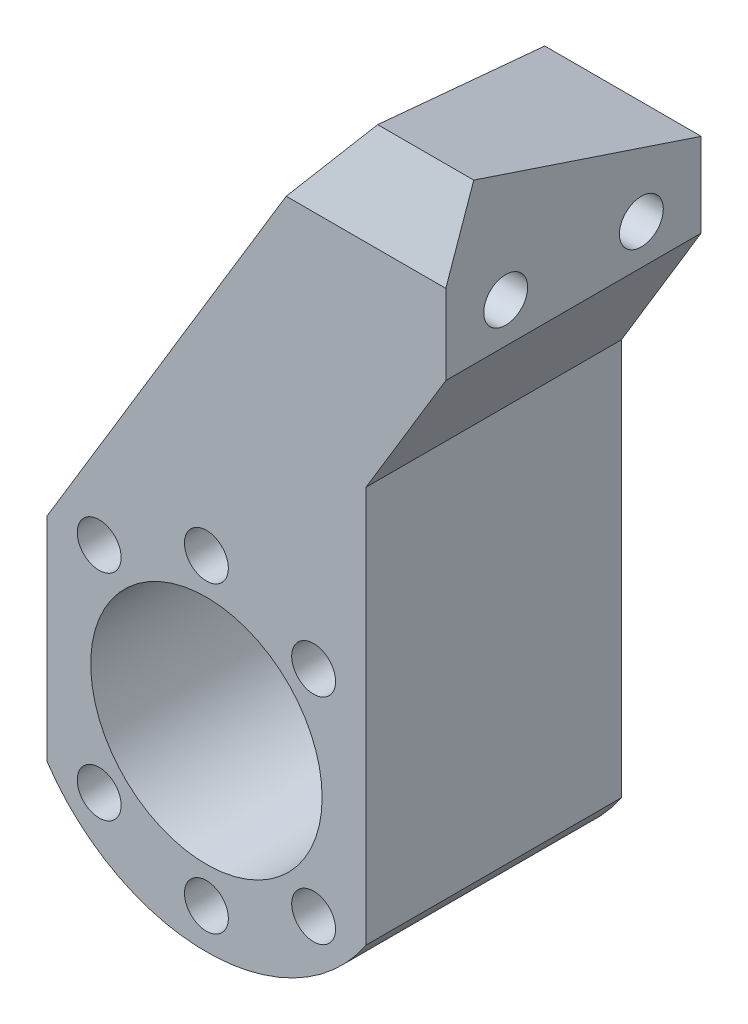
from build123d import *

# Parameters (mm, degrees)
ESQUISSE2_R             = 2.75
ESQUISSE2_R_2           = 14.5
BOSS_EXTRU_1_DEPTH      = 32
BOSS_EXTRU_4_DEPTH      = 32
ENL_V_MAT_EXTRU_3_REACH = 88.563
ESQUISSE10_R            = 2.75
BOSS_EXTRU_6_DEPTH      = 20
ENL_V_MAT_EXTRU_4_REACH = 87.165
ENL_V_MAT_EXTRU_5_REACH = 91.18
ESQUISSE13_R            = 6


with BuildPart() as part:
    # Esquisse2 → Boss.-Extru.1 (new body)
    with BuildSketch(Plane.XY):
        with BuildLine():
            Line((20, 13.266499161), (20, -13.266499161))
            ThreePointArc((20, -13.266499161), (0, -24), (-20, -13.266499161))
            Line((-20, -13.266499161), (-20, 13.266499161))
            ThreePointArc((-20, 13.266499161), (0, 24), (20, 13.266499161))
        make_face()
        with Locations((0, 19)):
            Circle(ESQUISSE2_R, mode=Mode.SUBTRACT)
        with Locations((-13.435028843, 13.435028843)):
            Circle(ESQUISSE2_R, mode=Mode.SUBTRACT)
        with Locations((13.435028843, 13.435028843)):
            Circle(ESQUISSE2_R, mode=Mode.SUBTRACT)
        with Locations((0, -19)):
            Circle(ESQUISSE2_R, mode=Mode.SUBTRACT)
        with Locations((13.435028843, -13.435028843)):
            Circle(ESQUISSE2_R, mode=Mode.SUBTRACT)
        with Locations((-13.435028843, -13.435028843)):
            Circle(ESQUISSE2_R, mode=Mode.SUBTRACT)
        Circle(ESQUISSE2_R_2, mode=Mode.SUBTRACT)
    extrude(amount=BOSS_EXTRU_1_DEPTH)

    # Esquisse7 → Boss.-Extru.4 (add)
    with BuildSketch(Plane(origin=(0, 0, 0), x_dir=(-1, 0, 0), z_dir=(0, 0, -1))):
        with BuildLine():
            Line((-10, 63.000996071), (20, 13.266499161))
            ThreePointArc((20, 13.266499161), (0, 24), (-20, 13.266499161))
            Line((-20, 13.266499161), (-20, 36.422830435))
            Line((-20, 36.422830435), (-30, 53.000996071))
            Line((-30, 53.000996071), (-30, 63.000996071))
            Line((-30, 63.000996071), (-10, 63.000996071))
        make_face()
    extrude(amount=-BOSS_EXTRU_4_DEPTH)

    # Enlèv. mat.-Extru.3: up to this plane
    enl_v_mat_extru_3_end = Plane(origin=(10, 63.000996071, 102.523188973), z_dir=(-0.8562805371039014, 0.5165110277400223, 0))
    # Esquisse10 → Enlèv. mat.-Extru.3 (cut, up to the surface)
    with BuildSketch(Plane(origin=(30, 0, 0), x_dir=(0, 0, -1), z_dir=(1, 0, 0)), mode=Mode.PRIVATE) as enl_v_mat_extru_3_sk1:
        with Locations((-24.5, 58.000996071)):
            Circle(ESQUISSE10_R)
    enl_v_mat_extru_3_tool1 = split(extrude(enl_v_mat_extru_3_sk1.sketch, amount=-ENL_V_MAT_EXTRU_3_REACH, mode=Mode.PRIVATE), bisect_by=enl_v_mat_extru_3_end, keep=Keep.BOTH, mode=Mode.PRIVATE)
    add(enl_v_mat_extru_3_tool1.solids().sort_by_distance((30, 58.000996, 24.5))[0], mode=Mode.SUBTRACT)
    # Esquisse10 → Enlèv. mat.-Extru.3 (cut, up to the surface)
    with BuildSketch(Plane(origin=(30, 0, 0), x_dir=(0, 0, -1), z_dir=(1, 0, 0)), mode=Mode.PRIVATE) as enl_v_mat_extru_3_sk2:
        with Locations((-7.5, 58.000996071)):
            Circle(ESQUISSE10_R)
    enl_v_mat_extru_3_tool2 = split(extrude(enl_v_mat_extru_3_sk2.sketch, amount=-ENL_V_MAT_EXTRU_3_REACH, mode=Mode.PRIVATE), bisect_by=enl_v_mat_extru_3_end, keep=Keep.BOTH, mode=Mode.PRIVATE)
    add(enl_v_mat_extru_3_tool2.solids().sort_by_distance((30, 58.000996, 7.5))[0], mode=Mode.SUBTRACT)

    # Esquisse11 → Boss.-Extru.6 (add)
    with BuildSketch(Plane(origin=(30, 0, 0), x_dir=(0, 0, -1), z_dir=(1, 0, 0))):
        Polygon((-32, 63.000996071), (0, 63.000996071), (0, 63.500996071), (-28.5, 73.000996071), align=None)
    extrude(amount=-BOSS_EXTRU_6_DEPTH)

    # Enlèv. mat.-Extru.4: up to this plane
    enl_v_mat_extru_4_end = Plane(origin=(10, 73.000996071, 28.5), z_dir=(0, 0.33035042472810594, 0.9438583563660174))
    # Esquisse12 → Enlèv. mat.-Extru.4 (cut, up to the surface)
    with BuildSketch(Plane(origin=(0, 0, 0), x_dir=(-1, 0, 0), z_dir=(0, 0, -1)), mode=Mode.PRIVATE) as enl_v_mat_extru_4_sk1:
        Polygon((-10, 63.000996071), (-17.962764916, 73.000996071), (-10, 73.000996071), align=None)
    enl_v_mat_extru_4_tool1 = split(extrude(enl_v_mat_extru_4_sk1.sketch, amount=-ENL_V_MAT_EXTRU_4_REACH, mode=Mode.PRIVATE), bisect_by=enl_v_mat_extru_4_end, keep=Keep.BOTH, mode=Mode.PRIVATE)
    add(enl_v_mat_extru_4_tool1.solids().sort_by_distance((12.654255, 69.667663, 0))[0], mode=Mode.SUBTRACT)

    # Esquisse13 → Enlèv. mat.-Extru.5 (cut, up to next)
    with BuildSketch(Plane(origin=(20, 0, 0), x_dir=(0, 0, -1), z_dir=(1, 0, 0)), mode=Mode.PRIVATE) as enl_v_mat_extru_5_sk1:
        with Locations((-7.5, 58.000996071)):
            Circle(ESQUISSE13_R)
    enl_v_mat_extru_5_tool1 = extrude(enl_v_mat_extru_5_sk1.sketch, amount=-ENL_V_MAT_EXTRU_5_REACH, mode=Mode.PRIVATE) & part.part
    # Esquisse13 → Enlèv. mat.-Extru.5 (cut, up to next)
    with BuildSketch(Plane(origin=(20, 0, 0), x_dir=(0, 0, -1), z_dir=(1, 0, 0)), mode=Mode.PRIVATE) as enl_v_mat_extru_5_sk2:
        with Locations((-24.5, 58.000996071)):
            Circle(ESQUISSE13_R)
    enl_v_mat_extru_5_tool2 = extrude(enl_v_mat_extru_5_sk2.sketch, amount=-ENL_V_MAT_EXTRU_5_REACH, mode=Mode.PRIVATE) & part.part
    add(enl_v_mat_extru_5_tool1.solids().sort_by_distance((20, 58.000996, 7.5))[0], mode=Mode.SUBTRACT)
    add(enl_v_mat_extru_5_tool2.solids().sort_by_distance((20, 58.000996, 24.5))[0], mode=Mode.SUBTRACT)


solid = part.part
